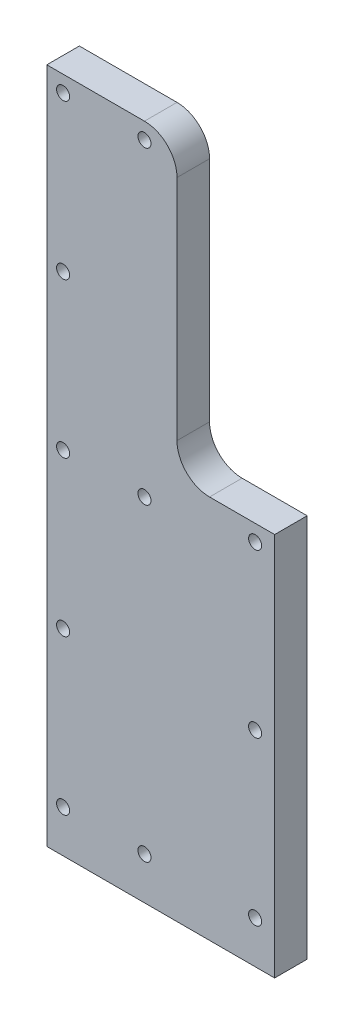
from build123d import *

# Parameters (mm, degrees)
SALIENTE_EXTRUIR1_DEPTH = 10
CROQUIS2_R              = 2
CORTAR_EXTRUIR1_DEPTH   = 213.132034356
CROQUIS3_W              = 70
CROQUIS3_H              = 8
SALIENTE_EXTRUIR2_DEPTH = 10


with BuildPart() as part:
    # Croquis1 → Saliente-Extruir1 (new body)
    with BuildSketch(Plane.XY):
        with BuildLine():
            Line((0, 0), (0, 200))
            Line((0, 200), (30, 200))
            ThreePointArc((30, 200), (37.071067812, 197.071067812), (40, 190))
            Line((40, 190), (40, 120))
            ThreePointArc((40, 120), (42.928932188, 112.928932188), (50, 110))
            Line((50, 110), (70, 110))
            Line((70, 110), (70, 0))
            Line((70, 0), (0, 0))
        make_face()
    extrude(amount=SALIENTE_EXTRUIR1_DEPTH)

    # Croquis2 → Cortar-Extruir1 (cut, through all)
    with BuildSketch(Plane.XY.offset(10)):
        with Locations((5, 195)):
            Circle(CROQUIS2_R)
        with Locations((5, 147.5)):
            Circle(CROQUIS2_R)
        with Locations((5, 100)):
            Circle(CROQUIS2_R)
        with Locations((5, 52.5)):
            Circle(CROQUIS2_R)
        with Locations((5, 5)):
            Circle(CROQUIS2_R)
        with Locations((64, 105)):
            Circle(CROQUIS2_R)
        with Locations((64, 55)):
            Circle(CROQUIS2_R)
        with Locations((64, 5)):
            Circle(CROQUIS2_R)
        with Locations((30, 195)):
            Circle(CROQUIS2_R)
        with Locations((30, 100)):
            Circle(CROQUIS2_R)
        with Locations((30, 5)):
            Circle(CROQUIS2_R)
    extrude(amount=-CORTAR_EXTRUIR1_DEPTH, mode=Mode.SUBTRACT)

    # Croquis3 → Saliente-Extruir2 (add)
    with BuildSketch(Plane.XY.offset(10)):
        with Locations((35, -4)):
            Rectangle(CROQUIS3_W, CROQUIS3_H)
    extrude(amount=-SALIENTE_EXTRUIR2_DEPTH)


solid = part.part
